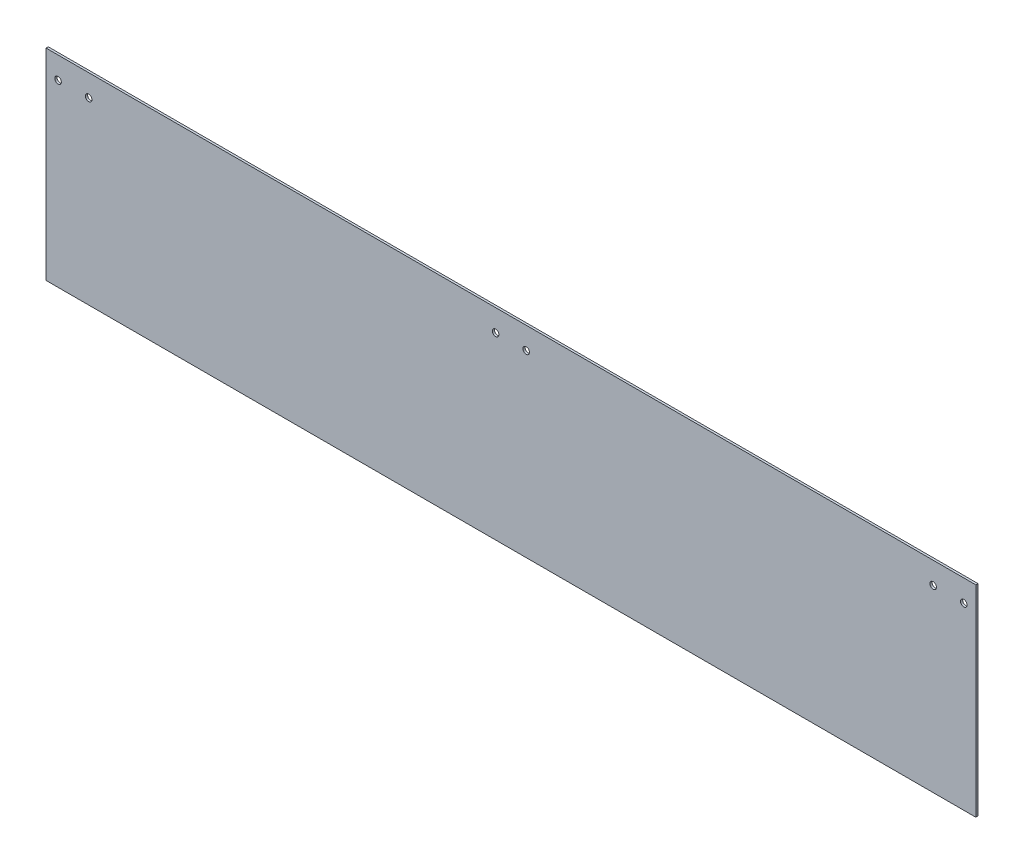
from build123d import *

# Parameters (mm, degrees)
SKETCH_1_W          = 425
SKETCH_1_H          = 92
EXTRUDE_1_DEPTH     = 1
SKETCH_2_R          = 1.5
CUT_EXTRUDE_1_DEPTH = 218.424124696


with BuildPart() as part:
    # 草图1 → 凸台-拉伸1 (new body)
    with BuildSketch(Plane.XY):
        Rectangle(SKETCH_1_W, SKETCH_1_H)
    extrude(amount=EXTRUDE_1_DEPTH)

    # 草图2 → 切除-拉伸1 (cut, through all)
    with BuildSketch(Plane.XY.offset(1)):
        with Locations((-7, 36)):
            Circle(SKETCH_2_R)
        with Locations((-207, 36)):
            Circle(SKETCH_2_R)
        with Locations((-193, 36)):
            Circle(SKETCH_2_R)
        with Locations(Location((193, 36, 0), (0, 0, 180))):
            Circle(SKETCH_2_R)
        with Locations(Location((207, 36, 0), (0, 0, 180))):
            Circle(SKETCH_2_R)
        with Locations(Location((7, 36, 0), (0, 0, 180))):
            Circle(SKETCH_2_R)
    extrude(amount=-CUT_EXTRUDE_1_DEPTH, mode=Mode.SUBTRACT)


solid = part.part
